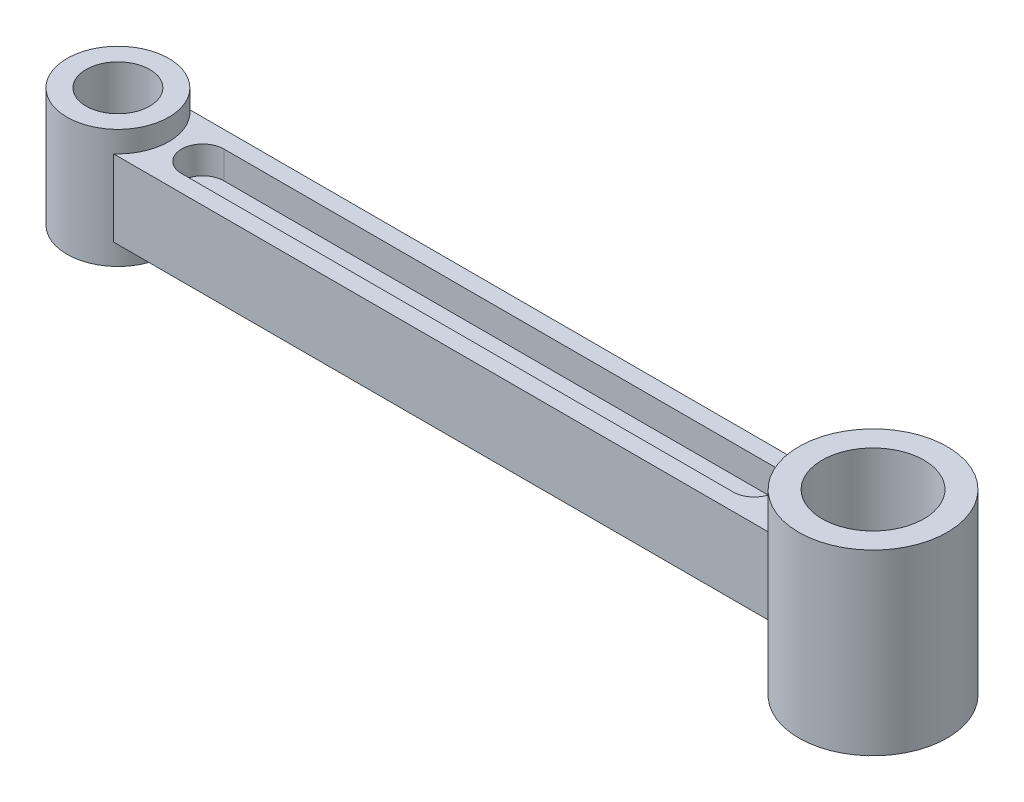
from build123d import *

# Parameters (mm, degrees)
SKETCH1_R           = 12
SKETCH1_R_2         = 7.5
BOSS_EXTRUDE2_DEPTH = 14
SKETCH6_R           = 17.5
SKETCH6_R_2         = 12
BOSS_EXTRUDE6_DEPTH = 21
BOSS_EXTRUDE7_DEPTH = 9
CUT_EXTRUDE1_DEPTH  = 6.5


with BuildPart() as part:
    # Sketch1 → Boss-Extrude2 (new, symmetric)
    with BuildSketch(Plane(origin=(0, 0, 0), x_dir=(1, 0, 0), z_dir=(0, 1, 0))):
        with Locations(Location((-108.996988396, 0, 0), (0, 0, 270))):
            Circle(SKETCH1_R)
        with Locations(Location((-108.996988396, 0, 0), (0, 0, 270))):
            Circle(SKETCH1_R_2, mode=Mode.SUBTRACT)
    extrude(amount=BOSS_EXTRUDE2_DEPTH, both=True)



with BuildPart() as body_2:
    # Sketch6 → Boss-Extrude6 (new, symmetric)
    with BuildSketch(Plane(origin=(0, 0, 0), x_dir=(1, 0, 0), z_dir=(0, 1, 0))):
        with Locations(Location((69.003011604, 0, 0), (0, 0, 90))):
            Circle(SKETCH6_R)
        with Locations(Location((69.003011604, 0, 0), (0, 0, 90))):
            Circle(SKETCH6_R_2, mode=Mode.SUBTRACT)
    extrude(amount=BOSS_EXTRUDE6_DEPTH, both=True)


with BuildPart() as part_1:
    add(part.part)

    add(body_2.part)  # Boss-Extrude7 merges body 2
    # Sketch10 → Boss-Extrude7 (add, symmetric)
    with BuildSketch(Plane(origin=(0, 0, 0), x_dir=(1, 0, 0), z_dir=(0, 1, 0))):
        with BuildLine():
            Line((53.994680585, 9), (-101.059734462, 9))
            ThreePointArc((-101.059734462, 9), (-96.996988396, 0), (-101.059734462, -9))
            Line((-101.059734462, -9), (53.994680585, -9))
            ThreePointArc((53.994680585, -9), (51.503011604, 0), (53.994680585, 9))
        make_face()
    extrude(amount=BOSS_EXTRUDE7_DEPTH, both=True)

    # Sketch11 → Cut-Extrude1 (cut)
    with BuildSketch(Plane(origin=(0, 9, 0), x_dir=(1, 0, 0), z_dir=(0, 1, 0))):
        with BuildLine():
            Line((-88.996988396, 5), (41.003011604, 5))
            ThreePointArc((41.003011604, 5), (46.003011604, 0), (41.003011604, -5))
            Line((41.003011604, -5), (-88.996988396, -5))
            ThreePointArc((-88.996988396, -5), (-93.996988396, 0), (-88.996988396, 5))
        make_face()
    cut_extrude1 = extrude(amount=-CUT_EXTRUDE1_DEPTH, mode=Mode.SUBTRACT)

    # Mirror1: Cut-Extrude1 across plane
    add(cut_extrude1.mirror(Plane.ZX), mode=Mode.SUBTRACT)


solid = part_1.part
